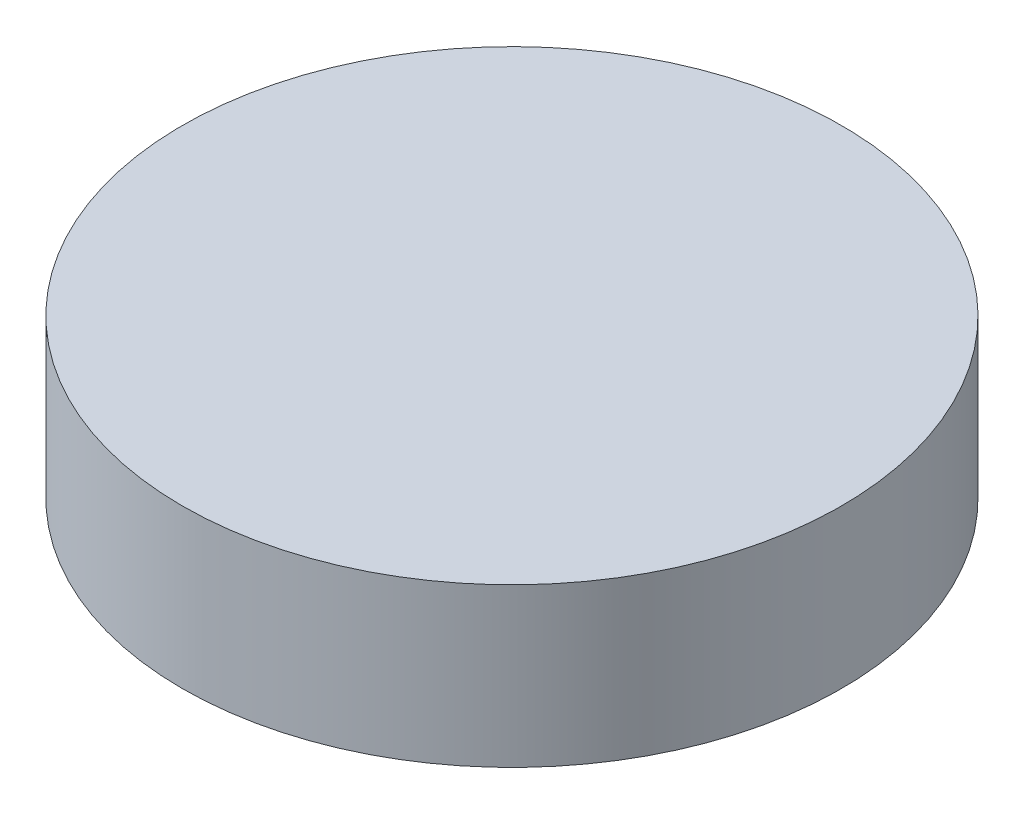
from build123d import *

# Parameters (mm, degrees)
SKETCH1_R               = 25
OVEN_AYAR_AYAGI_1_DEPTH = 12


with BuildPart() as part:
    # Sketch1 → OVEN_ayar_ayagi_1 (new body)
    with BuildSketch(Plane(origin=(0, 0, 0), x_dir=(1, 0, 0), z_dir=(0, 1, 0))):
        with Locations(Location((50, 50, 0), (0, 0, 270))):
            Circle(SKETCH1_R)
    extrude(amount=OVEN_AYAR_AYAGI_1_DEPTH)


solid = part.part
